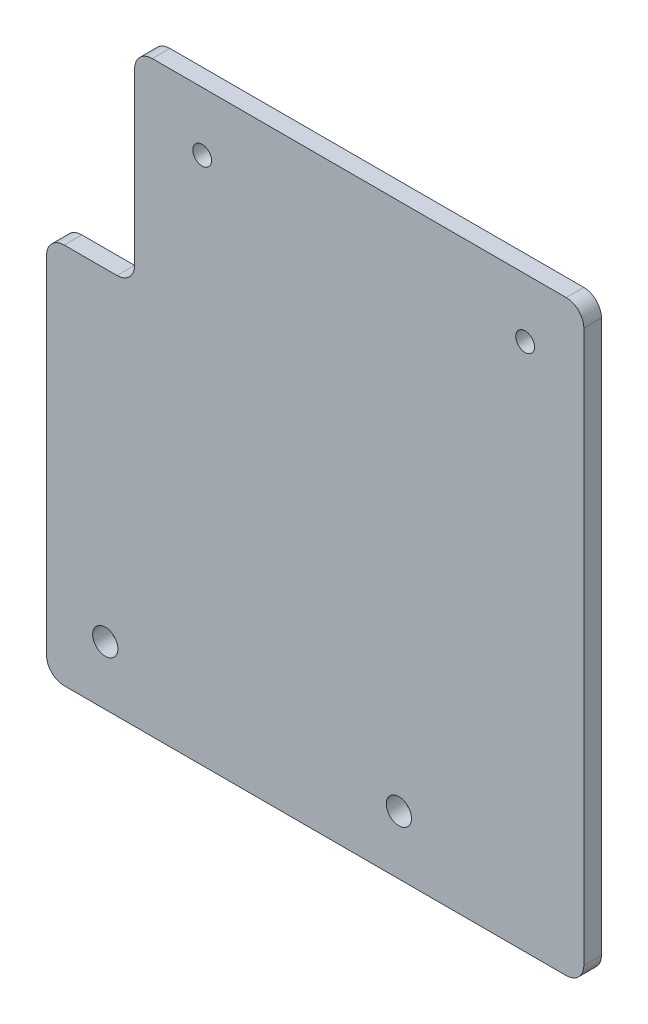
from build123d import *

# Parameters (mm, degrees)
SKETCH1_W            = 91.5
SKETCH1_H            = 100
BOSS_EXTRUDE1_DEPTH  = 3
M4_CLEARANCE_HOLE1_D = 4.3
M3_CLEARANCE_HOLE1_D = 3.2
SKETCH6_W            = 15
SKETCH6_H            = 35
CUT_EXTRUDE1_DEPTH   = 107.30733747
FILLET1_R            = 3


with BuildPart() as part:
    # Sketch1 → Boss-Extrude1 (new body)
    with BuildSketch(Plane.XY):
        with Locations((10.75, 40)):
            Rectangle(SKETCH1_W, SKETCH1_H)
    extrude(amount=BOSS_EXTRUDE1_DEPTH)

    # M4 Clearance Hole1 (through all)
    with Locations(Plane.XY.offset(3)):
        with Locations((-25, 0), (25, 0)):
            Hole(M4_CLEARANCE_HOLE1_D / 2)

    # M3 Clearance Hole1 (through all)
    with Locations(Plane.XY.offset(3)):
        with Locations((-8.5, 80), (46.5, 80)):
            Hole(M3_CLEARANCE_HOLE1_D / 2)

    # Sketch6 → Cut-Extrude1 (cut, through all)
    with BuildSketch(Plane.XY.offset(3)):
        with Locations((-27.5, 72.5)):
            Rectangle(SKETCH6_W, SKETCH6_H)
    extrude(amount=-CUT_EXTRUDE1_DEPTH, mode=Mode.SUBTRACT)

    # Fillet1
    fillet1_edges = [part.edges().sort_by_distance(p)[0] for p in [
        (-20, 90, 1.5),
        (-20, 55, 1.5),
        (-35, 55, 1.5),
        (56.5, 90, 1.5),
        (56.5, -10, 1.5),
        (-35, -10, 1.5),
    ]]
    fillet(fillet1_edges, radius=FILLET1_R)


solid = part.part
